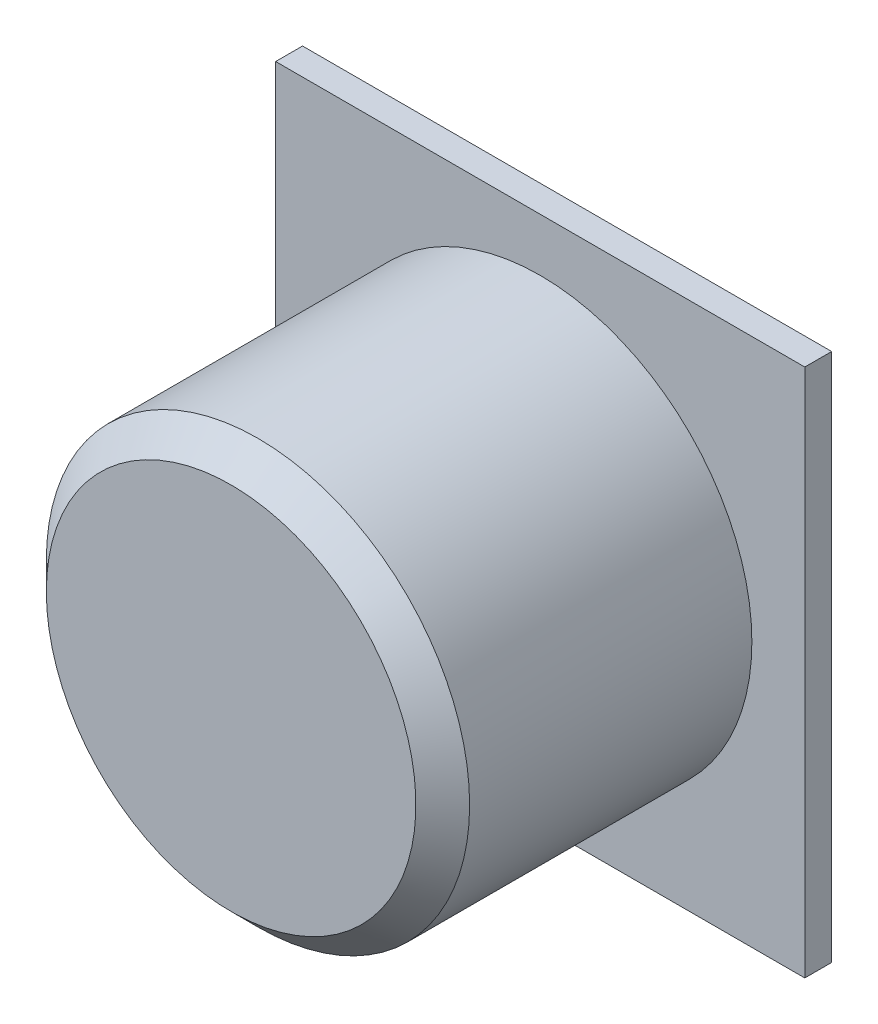
from build123d import *

# Parameters (mm, degrees)
SKETCH1_W           = 100
SKETCH1_H           = 100
BOSS_EXTRUDE1_DEPTH = 5.08
SKETCH2_R           = 40
BOSS_EXTRUDE2_DEPTH = 63.5
CHAMFER1_SIZE       = 5.08


with BuildPart() as part:
    # Sketch1 → Boss-Extrude1 (new body)
    with BuildSketch(Plane.XY):
        Rectangle(SKETCH1_W, SKETCH1_H)
    extrude(amount=BOSS_EXTRUDE1_DEPTH)

    # Sketch2 → Boss-Extrude2 (add)
    with BuildSketch(Plane.XY):
        Circle(SKETCH2_R)
    extrude(amount=BOSS_EXTRUDE2_DEPTH)

    # Chamfer1
    chamfer1_edges = [part.edges().sort_by_distance(p)[0] for p in [
        (-40, 0, 63.5),
    ]]
    chamfer(chamfer1_edges, length=CHAMFER1_SIZE)


solid = part.part
